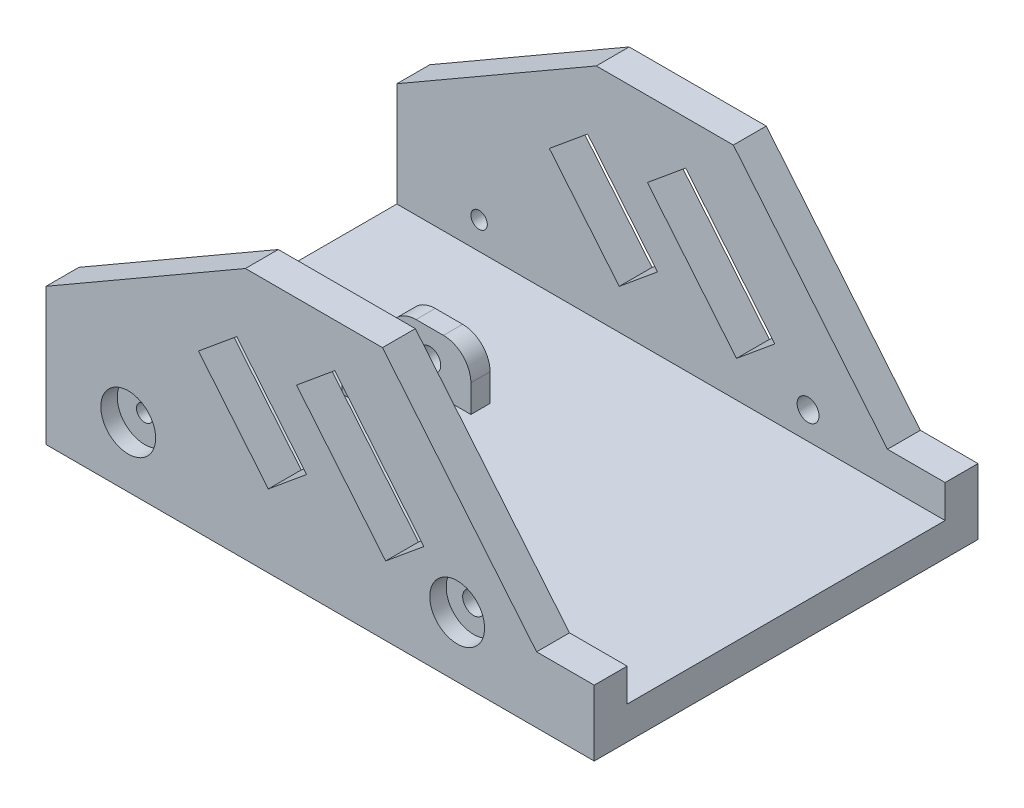
from build123d import *

# Parameters (mm, degrees)
SKETCH1_W               = 100
SKETCH1_H               = 70
BOSS_EXTRUDE1_DEPTH     = 6
SKETCH2_W               = 100
SKETCH2_H               = 6
BOSS_EXTRUDE2_DEPTH     = 50
CUT_EXTRUDE1_DEPTH      = 103.645019363
CUT_EXTRUDE1_DEPTH_BACK = 103.645019363
SKETCH3_R               = 1.5
SKETCH3_R_2             = 2
CUT_EXTRUDE2_DEPTH      = 103.645019363
CUT_EXTRUDE2_DEPTH_BACK = 103.645019363
CUT_EXTRUDE3_DEPTH      = 103.645019363
CUT_EXTRUDE4_DEPTH      = 103.645019363
CUT_EXTRUDE4_DEPTH_BACK = 103.645019363
CUT_EXTRUDE5_DEPTH      = 103.645019363
CUT_EXTRUDE5_DEPTH_BACK = 103.645019363
SKETCH9_W               = 15
SKETCH9_H               = 3.5
BOSS_EXTRUDE3_DEPTH     = 10
CUT_EXTRUDE8_START      = -3.5
SKETCH11_R              = 2
CUT_EXTRUDE8_DEPTH      = 12
FILLET1_R               = 5
FILLET2_R               = 5
FILLET3_R               = 5
FILLET4_R               = 5
CUT_EXTRUDE9_DEPTH      = 103.645019363
SKETCH14_R              = 5
CUT_EXTRUDE10_DEPTH     = 3
CUT_EXTRUDE11_START     = -3
SKETCH15_R              = 5
CUT_EXTRUDE11_DEPTH     = 3
SKETCH16_R              = 5
CUT_EXTRUDE12_DEPTH     = 3
CUT_EXTRUDE13_START     = -3
SKETCH17_R              = 5
CUT_EXTRUDE13_DEPTH     = 3


with BuildPart() as part:
    # Sketch1 → Boss-Extrude1 (new body)
    with BuildSketch(Plane(origin=(0, 0, 0), x_dir=(1, 0, 0), z_dir=(0, 1, 0))):
        Rectangle(SKETCH1_W, SKETCH1_H)
    extrude(amount=BOSS_EXTRUDE1_DEPTH)

    # Sketch2 → Boss-Extrude2 (add)
    with BuildSketch(Plane(origin=(0, 6, 0), x_dir=(1, 0, 0), z_dir=(0, 1, 0))):
        with Locations((0, 32)):
            Rectangle(SKETCH2_W, SKETCH2_H)
        with Locations((0, -32)):
            Rectangle(SKETCH2_W, SKETCH2_H)
    extrude(amount=BOSS_EXTRUDE2_DEPTH)

    # Sketch3 → Cut-Extrude1 (cut, two sides: drawn at the far end of the back side and taken through both)
    with BuildSketch(Plane.XY.offset(35).offset(-CUT_EXTRUDE1_DEPTH_BACK)):
        with Locations((-35, 11)):
            Circle(SKETCH3_R)
        with Locations((25, 11)):
            Circle(SKETCH3_R_2)
    extrude(amount=CUT_EXTRUDE1_DEPTH + CUT_EXTRUDE1_DEPTH_BACK, mode=Mode.SUBTRACT)

    # Sketch4 → Cut-Extrude2 (cut, two sides: drawn at the far end of the back side and taken through both)
    with BuildSketch(Plane.XY.offset(35).offset(-CUT_EXTRUDE2_DEPTH_BACK)):
        Polygon((-50, 25), (3.693575035, 56), (-50, 56), align=None)
    extrude(amount=CUT_EXTRUDE2_DEPTH + CUT_EXTRUDE2_DEPTH_BACK, mode=Mode.SUBTRACT)

    # Sketch5 → Cut-Extrude3 (cut, through all)
    with BuildSketch(Plane.XY.offset(35)):
        Polygon((26.846787517, 56), (50, 28), (50, 56), align=None)
    extrude(amount=-CUT_EXTRUDE3_DEPTH, mode=Mode.SUBTRACT)

    # Sketch6 → Cut-Extrude4 (cut, two sides: drawn at the far end of the back side and taken through both)
    with BuildSketch(Plane.XY.offset(35).offset(-CUT_EXTRUDE4_DEPTH_BACK)):
        Polygon((16.600357162, 47.527222171), (39.753569645, 19.527222171), (47.460108019, 25.899762189), (24.306895537, 53.899762189), align=None)
    extrude(amount=CUT_EXTRUDE4_DEPTH + CUT_EXTRUDE4_DEPTH_BACK, mode=Mode.SUBTRACT)

    # Sketch7 → Cut-Extrude5 (cut, two sides: drawn at the far end of the back side and taken through both)
    with BuildSketch(Plane.XY.offset(35).offset(-CUT_EXTRUDE5_DEPTH_BACK)):
        Polygon((2.673241004, 38.01310693), (-4.304705141, 32.243040152), (11.948586847, 12.587358417), (18.926532993, 18.357425196), align=None)
        Polygon((-15.212346405, 34.449406206), (-22.19029255, 28.679339427), (-9.445212514, 13.266262678), (-2.467266369, 19.036329456), align=None)
    extrude(amount=CUT_EXTRUDE5_DEPTH + CUT_EXTRUDE5_DEPTH_BACK, mode=Mode.SUBTRACT)

    # Sketch9 → Boss-Extrude3 (add)
    with BuildSketch(Plane(origin=(0, 6, 0), x_dir=(1, 0, 0), z_dir=(0, 1, 0))):
        with Locations((-17.5, 4.25)):
            Rectangle(SKETCH9_W, SKETCH9_H)
        with Locations((-17.5, -4.25)):
            Rectangle(SKETCH9_W, SKETCH9_H)
    extrude(amount=BOSS_EXTRUDE3_DEPTH)

    # Sketch11 → Cut-Extrude8 (cut)
    with BuildSketch(Plane.XY.offset(-2.5).offset(CUT_EXTRUDE8_START)):
        with Locations((-17.5, 11)):
            Circle(SKETCH11_R)
    extrude(amount=CUT_EXTRUDE8_DEPTH, mode=Mode.SUBTRACT)

    # Fillet1
    fillet1_edges = [part.edges().sort_by_distance(p)[0] for p in [
        (-25, 16, -4.25),
    ]]
    fillet(fillet1_edges, radius=FILLET1_R)

    # Fillet2
    fillet2_edges = [part.edges().sort_by_distance(p)[0] for p in [
        (-10, 16, -4.25),
    ]]
    fillet(fillet2_edges, radius=FILLET2_R)

    # Fillet3
    fillet3_edges = [part.edges().sort_by_distance(p)[0] for p in [
        (-25, 16, 4.25),
    ]]
    fillet(fillet3_edges, radius=FILLET3_R)

    # Fillet4
    fillet4_edges = [part.edges().sort_by_distance(p)[0] for p in [
        (-10, 16, 4.25),
    ]]
    fillet(fillet4_edges, radius=FILLET4_R)

    # Sketch13 → Cut-Extrude9 (cut, through all)
    with BuildSketch(Plane(origin=(0, 0, -35), x_dir=(-1, 0, 0), z_dir=(0, 0, -1))):
        Polygon((-50, 12), (-39.487682116, 12), (-11.373066959, 46), (13.626933041, 46), (-3.693575035, 56), (-26.846787517, 56), (-50, 28), align=None)
    extrude(amount=-CUT_EXTRUDE9_DEPTH, mode=Mode.SUBTRACT)

    # Sketch14 → Cut-Extrude10 (cut)
    with BuildSketch(Plane.XY.offset(35)):
        with Locations((25, 11)):
            Circle(SKETCH14_R)
    extrude(amount=-CUT_EXTRUDE10_DEPTH, mode=Mode.SUBTRACT)

    # Sketch15 → Cut-Extrude11 (cut)
    with BuildSketch(Plane(origin=(0, 0, -35), x_dir=(-1, 0, 0), z_dir=(0, 0, -1)).offset(CUT_EXTRUDE11_START)):
        with Locations(Location((-25, 11, 0), (0, 0, 180))):
            Circle(SKETCH15_R)
    extrude(amount=CUT_EXTRUDE11_DEPTH, mode=Mode.SUBTRACT)

    # Sketch16 → Cut-Extrude12 (cut)
    with BuildSketch(Plane(origin=(0, 0, -35), x_dir=(-1, 0, 0), z_dir=(0, 0, -1))):
        with Locations((35, 11)):
            Circle(SKETCH16_R)
    extrude(amount=-CUT_EXTRUDE12_DEPTH, mode=Mode.SUBTRACT)

    # Sketch17 → Cut-Extrude13 (cut)
    with BuildSketch(Plane.XY.offset(35).offset(CUT_EXTRUDE13_START)):
        with Locations(Location((-35, 11, 0), (0, 0, 180))):
            Circle(SKETCH17_R)
    extrude(amount=CUT_EXTRUDE13_DEPTH, mode=Mode.SUBTRACT)


solid = part.part
